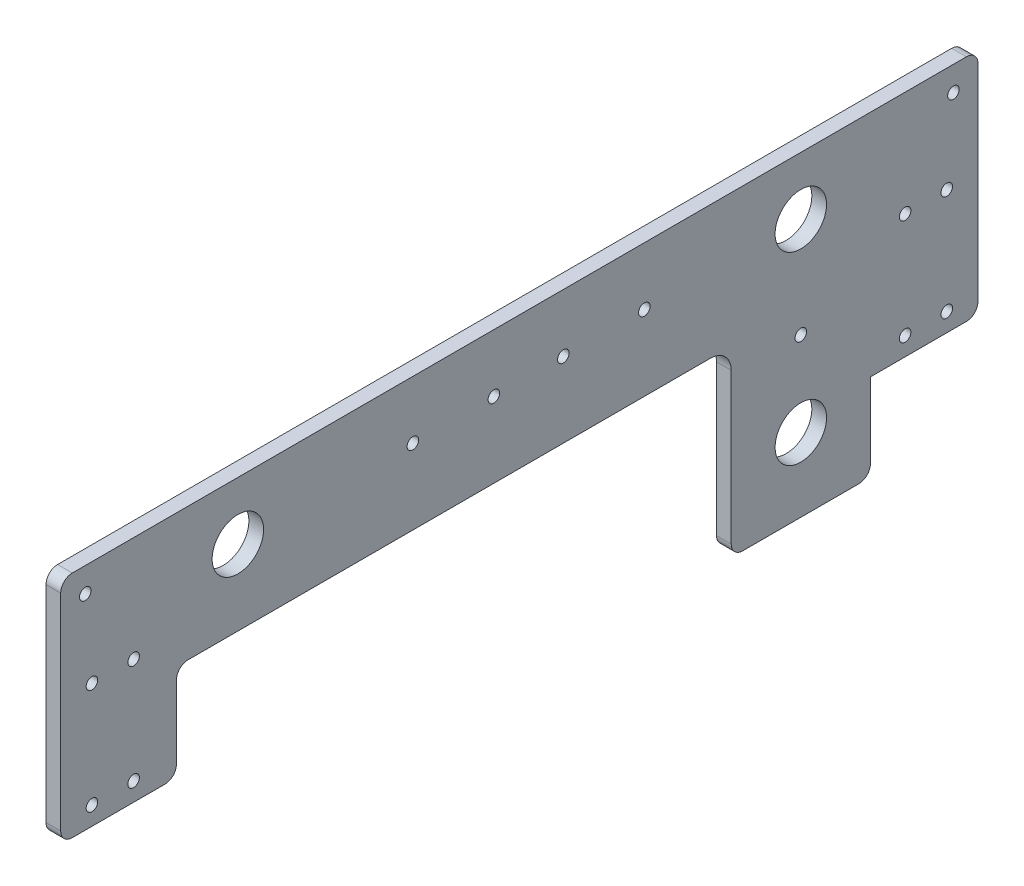
from build123d import *

# Parameters (mm, degrees)
CROQUIS1_R              = 11.115
CROQUIS1_R_2            = 2.5
SALIENTE_EXTRUIR1_DEPTH = 6.35
CROQUIS3_R              = 2.5
CORTAR_EXTRUIR1_DEPTH   = 10
REDONDEO1_R             = 5


with BuildPart() as part:
    # Croquis1 → Saliente-Extruir1 (new body)
    with BuildSketch(Plane(origin=(0, 0, 0), x_dir=(0, 0, -1), z_dir=(1, 0, 0))):
        with BuildLine():
            Line((-30.06, -68.26), (-30.06, 1.76))
            ThreePointArc((-30.06, 1.76), (-32.696038969, 8.123961031), (-39.06, 10.76))
            Line((-39.06, 10.76), (-269.71, 10.76))
            Line((-269.71, 10.76), (-269.71, -30.77))
            Line((-269.71, -30.77), (-319.71, -30.77))
            Line((-319.71, -30.77), (-319.71, 10.76))
            Line((-319.71, 10.76), (-319.71, 68.26))
            Line((-319.71, 68.26), (21.06, 68.26))
            Line((21.06, 68.26), (76.54, 68.26))
            Line((76.54, 68.26), (76.54, -30.77))
            Line((76.54, -30.77), (30.06, -30.77))
            Line((30.06, -30.77), (30.06, -68.26))
            Line((30.06, -68.26), (-30.06, -68.26))
        make_face()
        with Locations((0, 43.26)):
            Circle(CROQUIS1_R, mode=Mode.SUBTRACT)
        with Locations((0, -36.51)):
            Circle(CROQUIS1_R, mode=Mode.SUBTRACT)
        with Locations((-243.18, 43.26)):
            Circle(CROQUIS1_R, mode=Mode.SUBTRACT)
        Circle(CROQUIS1_R_2, mode=Mode.SUBTRACT)
        with Locations((-67.59, 43.26)):
            Circle(CROQUIS1_R_2, mode=Mode.SUBTRACT)
        with Locations((-167.59, 43.26)):
            Circle(CROQUIS1_R_2, mode=Mode.SUBTRACT)
        with Locations((-132.59, 43.26)):
            Circle(CROQUIS1_R_2, mode=Mode.SUBTRACT)
        with Locations((-102.59, 43.26)):
            Circle(CROQUIS1_R_2, mode=Mode.SUBTRACT)
    extrude(amount=SALIENTE_EXTRUIR1_DEPTH)

    # Croquis3 → Cortar-Extruir1 (cut)
    with BuildSketch(Plane(origin=(6.35, 0, 0), x_dir=(0, 0, -1), z_dir=(1, 0, 0))):
        with Locations((-288.21, -22.77)):
            Circle(CROQUIS3_R)
        with Locations((-306.21, -22.77)):
            Circle(CROQUIS3_R)
        with Locations((-306.21, 22.78)):
            Circle(CROQUIS3_R)
        with Locations((-288.21, 22.78)):
            Circle(CROQUIS3_R)
        with Locations((45.04, -22.77)):
            Circle(CROQUIS3_R)
        with Locations((63.04, -22.77)):
            Circle(CROQUIS3_R)
        with Locations((45.04, 22.78)):
            Circle(CROQUIS3_R)
        with Locations((63.04, 22.78)):
            Circle(CROQUIS3_R)
        with Locations((-309.103398282, 57.653398282)):
            Circle(CROQUIS3_R)
        with Locations((65.933398282, 57.653398282)):
            Circle(CROQUIS3_R)
    extrude(amount=-CORTAR_EXTRUIR1_DEPTH, mode=Mode.SUBTRACT)

    # Redondeo1
    redondeo1_edges = [part.edges().sort_by_distance(p)[0] for p in [
        (3.175, -68.26, -30.06),
        (3.175, -68.26, 30.06),
        (3.175, 10.76, 269.71),
        (3.175, -30.77, 269.71),
        (3.175, -30.77, 319.71),
        (3.175, 68.26, 319.71),
        (3.175, 68.26, -76.54),
        (3.175, -30.77, -76.54),
    ]]
    fillet(redondeo1_edges, radius=REDONDEO1_R)


solid = part.part
